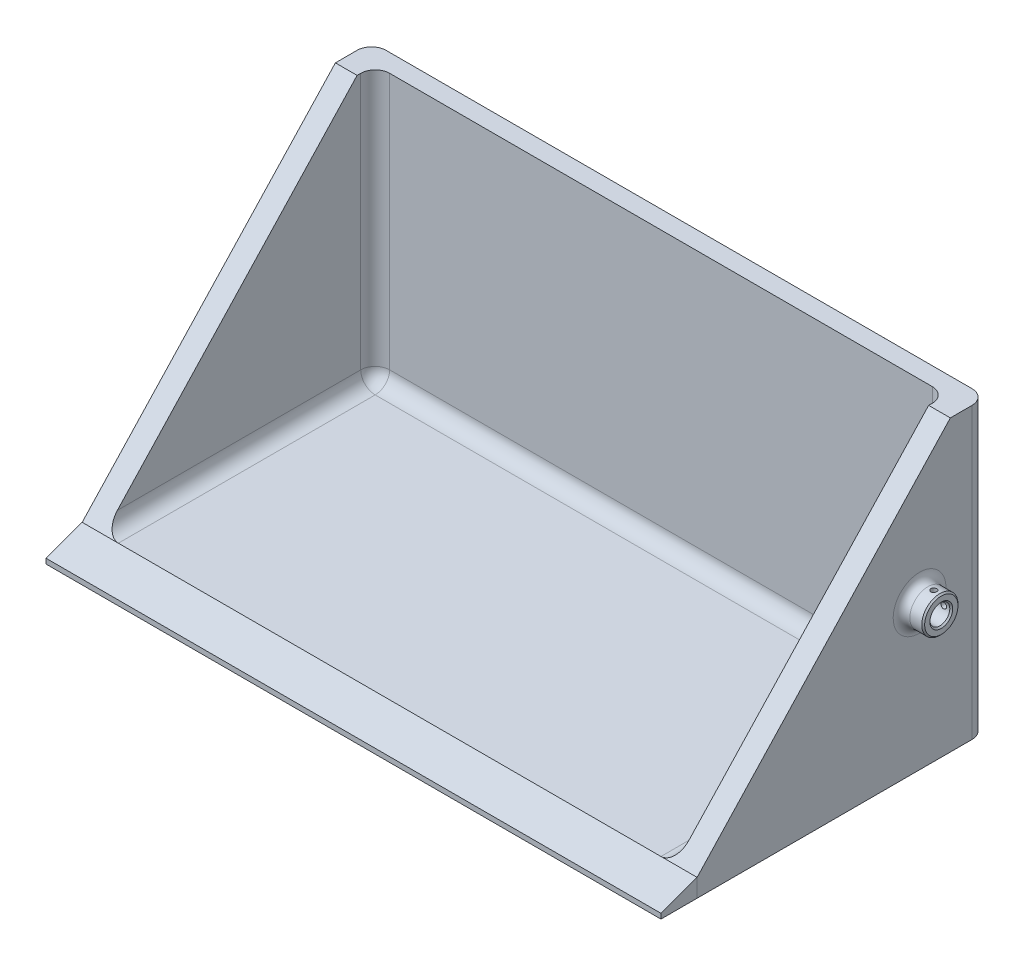
from build123d import *

# Parameters (mm, degrees)
SKETCH1_W           = 215.9
SKETCH1_H           = 101.6
BOSS_EXTRUDE1_DEPTH = 3.175
BOSS_EXTRUDE2_DEPTH = 7.62
SKETCH4_W           = 200.66
SKETCH4_H           = 6.35
BOSS_EXTRUDE3_DEPTH = 95.25
BOSS_EXTRUDE4_DEPTH = 215.9
FILLET2_R           = 5.08
FILLET3_R           = 5.08
SKETCH6_R           = 6.35
SKETCH6_R_2         = 3.4925
BOSS_EXTRUDE5_DEPTH = 7.62
FILLET4_R           = 2.921
CHAMFER1_SIZE       = 0.508
SKETCH7_R           = 1.0033
CUT_EXTRUDE1_DEPTH  = 3.81
CIRPATTERN1_COUNT   = 2
CIRPATTERN1_ANGLE   = 90


with BuildPart() as part:
    # Sketch1 → Boss-Extrude1 (new, symmetric)
    with BuildSketch(Plane(origin=(0, 0, 0), x_dir=(1, 0, 0), z_dir=(0, 1, 0))):
        Rectangle(SKETCH1_W, SKETCH1_H)
    extrude(amount=BOSS_EXTRUDE1_DEPTH, both=True)

    # Sketch3 → Boss-Extrude2 (add)
    with BuildSketch(Plane.ZY.offset(107.95)):
        Polygon((-50.8, 3.175), (-50.8, 98.425), (-38.1, 98.425), (50.8, 3.175), align=None)
    boss_extrude2 = extrude(amount=-BOSS_EXTRUDE2_DEPTH)

    # Mirror1: Boss-Extrude2 across plane
    add(boss_extrude2.mirror(Plane(origin=(0, 0, 0), x_dir=(0, 0, 1), z_dir=(1, 0, 0))))

    # Sketch4 → Boss-Extrude3 (add)
    with BuildSketch(Plane(origin=(0, 3.175, 0), x_dir=(1, 0, 0), z_dir=(0, 1, 0))):
        with Locations((0, 47.625)):
            Rectangle(SKETCH4_W, SKETCH4_H)
    extrude(amount=BOSS_EXTRUDE3_DEPTH)

    # Fillet2
    fillet2_edges = [part.edges().sort_by_distance(p)[0] for p in [
        (100.33, 3.175, 3.175),
        (-100.33, 3.175, 3.175),
        (-100.33, 50.8, -44.45),
        (0, 3.175, -44.45),
        (100.33, 50.8, -44.45),
    ]]
    fillet(fillet2_edges, radius=FILLET2_R)

    # Fillet3
    fillet3_edges = [part.edges().sort_by_distance(p)[0] for p in [
        (-107.95, 47.625, -50.8),
        (107.95, 47.625, -50.8),
    ]]
    fillet(fillet3_edges, radius=FILLET3_R)

    # Sketch6 → Boss-Extrude5 (add)
    with BuildSketch(Plane(origin=(107.95, 0, 0), x_dir=(0, 0, -1), z_dir=(1, 0, 0))):
        with Locations(Location((27.305, 47.625, 0), (0, 0, 180))):
            Circle(SKETCH6_R)
        with Locations(Location((27.305, 47.625, 0), (0, 0, 180))):
            Circle(SKETCH6_R_2, mode=Mode.SUBTRACT)
    extrude(amount=BOSS_EXTRUDE5_DEPTH)

    # Fillet4
    fillet4_edges = [part.edges().sort_by_distance(p)[0] for p in [
        (107.95, 47.625, -33.655),
    ]]
    fillet(fillet4_edges, radius=FILLET4_R)

    # Chamfer1
    chamfer1_edges = [part.edges().sort_by_distance(p)[0] for p in [
        (115.57, 47.625, -33.655),
        (115.57, 47.625, -30.7975),
    ]]
    chamfer(chamfer1_edges, length=CHAMFER1_SIZE)

    # Sketch7 → Cut-Extrude1 (cut)
    with BuildSketch(Plane(origin=(0, 53.975, 0), x_dir=(1, 0, 0), z_dir=(0, 1, 0))):
        with Locations(Location((112.9665, 27.305, 0), (0, 0, 270))):
            Circle(SKETCH7_R)
    cut_extrude1 = extrude(amount=-CUT_EXTRUDE1_DEPTH, mode=Mode.SUBTRACT)

    # CirPattern1: Cut-Extrude1 ×2 about axis
    cirpattern1_axis = Axis((115.57, 47.625, -27.305), (-1, 0, 0))
    for i in range(1, CIRPATTERN1_COUNT):
        add(cut_extrude1.rotate(cirpattern1_axis, i * CIRPATTERN1_ANGLE / (CIRPATTERN1_COUNT - 1)), mode=Mode.SUBTRACT)


with BuildPart() as body_2:
    # Sketch5 → Boss-Extrude4 (new body)
    with BuildSketch(Plane.ZY.offset(107.95)):
        Polygon((63.5, -3.175), (50.8, -3.175), (50.8, 3.175), (63.5, -1.397), align=None)
    extrude(amount=-BOSS_EXTRUDE4_DEPTH)


solid = Compound([part.part, body_2.part])
